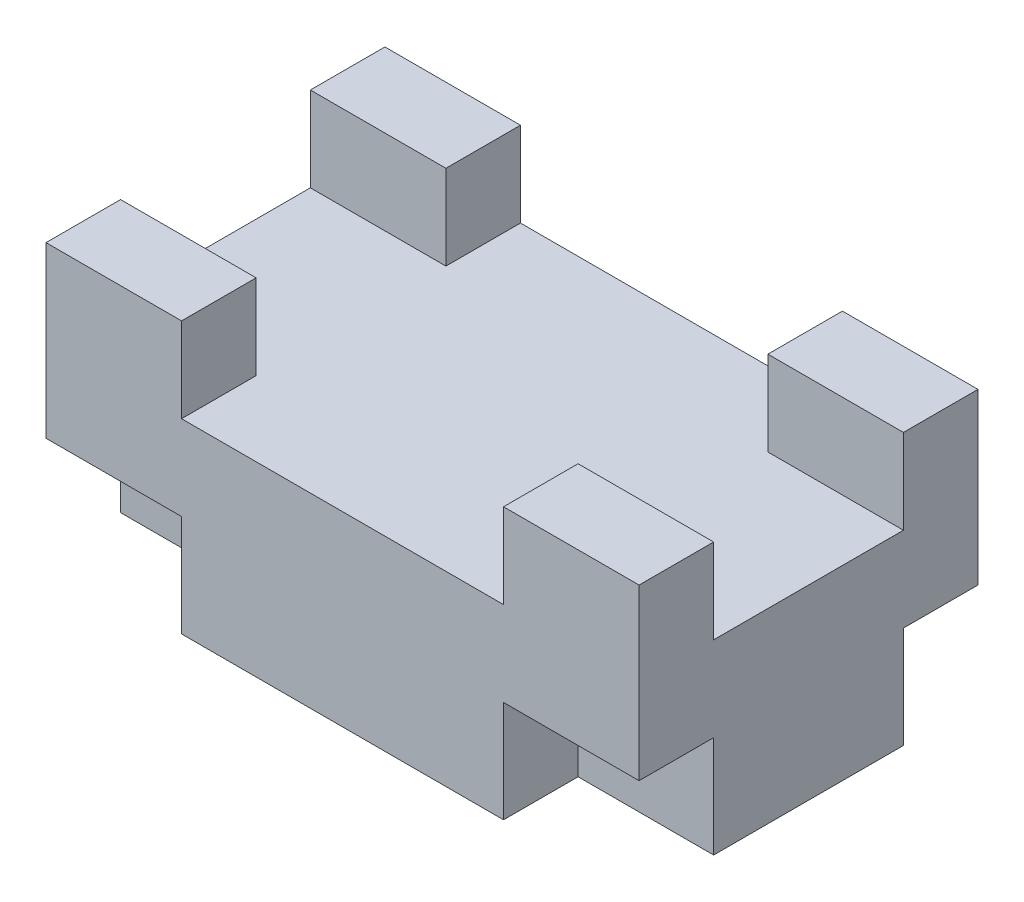
from build123d import *

# Parameters (mm, degrees)
BOSS_EXTRUDE1_DEPTH = 30
SKETCH3_W           = 175
SKETCH3_H           = 100
BOSS_EXTRUDE2_DEPTH = 25
SKETCH3_3_W         = 40
SKETCH3_3_H         = 22
BOSS_EXTRUDE3_DEPTH = 50


with BuildPart() as part:
    # Sketch2 → Boss-Extrude1 (new body)
    with BuildSketch(Plane(origin=(0, 0, 0), x_dir=(1, 0, 0), z_dir=(0, 1, 0))):
        Polygon((-40, 100), (-135, 100), (-135, 78), (-175, 78), (-175, 22), (-135, 22), (-135, 0), (-40, 0), (-40, 22), (0, 22), (0, 78), (-40, 78), align=None)
    extrude(amount=BOSS_EXTRUDE1_DEPTH)

    # Sketch3 → Boss-Extrude2 (add)
    with BuildSketch(Plane(origin=(0, 30, 0), x_dir=(1, 0, 0), z_dir=(0, 1, 0))):
        with Locations((-87.5, 50)):
            Rectangle(SKETCH3_W, SKETCH3_H)
    extrude(amount=BOSS_EXTRUDE2_DEPTH)

    # Sketch3<3> → Boss-Extrude3 (add)
    with BuildSketch(Plane(origin=(0, 30, 0), x_dir=(1, 0, 0), z_dir=(0, 1, 0))):
        with Locations((-155, 89)):
            Rectangle(SKETCH3_3_W, SKETCH3_3_H)
        with Locations((-155, 11)):
            Rectangle(SKETCH3_3_W, SKETCH3_3_H)
        with Locations((-20, 89)):
            Rectangle(SKETCH3_3_W, SKETCH3_3_H)
        with Locations((-20, 11)):
            Rectangle(SKETCH3_3_W, SKETCH3_3_H)
    extrude(amount=BOSS_EXTRUDE3_DEPTH)


solid = part.part
